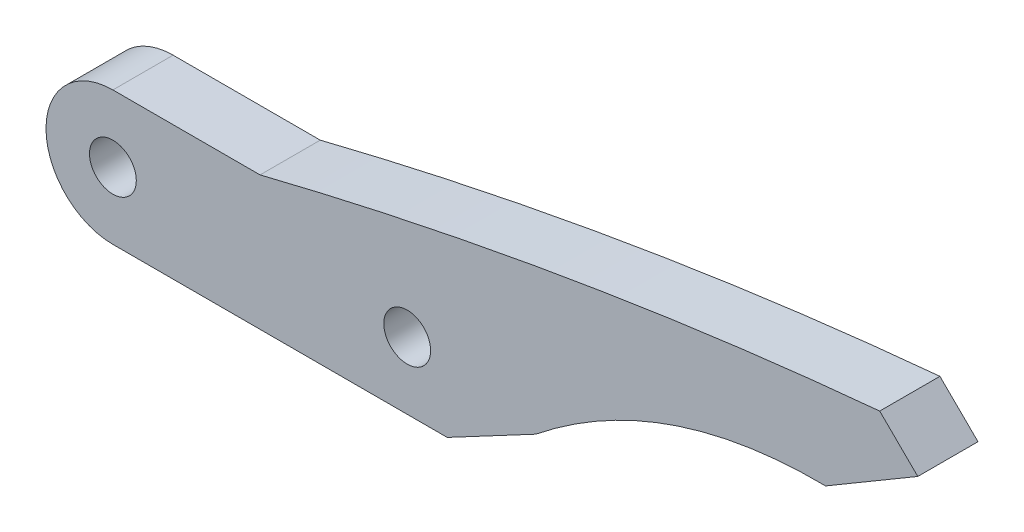
from build123d import *

# Parameters (mm, degrees)
SKETCH1_R           = 5
SKETCH1_R_2         = 1.75
BOSS_EXTRUDE1_DEPTH = 4.5
BOSS_EXTRUDE2_START = -4.5
BOSS_EXTRUDE2_DEPTH = 4.5


with BuildPart() as part:
    # Sketch1 → Boss-Extrude1 (new body)
    # profile 1 of 3: a face of its own
    with BuildSketch(Plane.XY):
        with BuildLine():
            Line((11.000000016, 5), (-11, 5))
            ThreePointArc((-11, 5), (-7.464466094, 3.535533906), (-6, 0))
            ThreePointArc((-6, 0), (-7.464466094, -3.535533906), (-11, -5))
            Line((-11, -5), (11, -5))
            ThreePointArc((11, -5), (6, 8e-09), (11.000000016, 5))
        make_face()
    # profile 2 of 3: a face of its own
    with BuildSketch(Plane.XY):
        with Locations((-11, 0)):
            Circle(SKETCH1_R)
        with Locations((-11, 0)):
            Circle(SKETCH1_R_2, mode=Mode.SUBTRACT)
    # profile 3 of 3: a face of its own
    with BuildSketch(Plane.XY):
        with Locations((11, 0)):
            Circle(SKETCH1_R)
        with Locations((11, 0)):
            Circle(SKETCH1_R_2, mode=Mode.SUBTRACT)
    extrude(amount=BOSS_EXTRUDE1_DEPTH)

    # Sketch2 → Boss-Extrude2 (add)
    with BuildSketch(Plane.XY.offset(4.5).offset(BOSS_EXTRUDE2_START)):
        with BuildLine():
            Line((46.316479083, 12.87), (49.163214054, 10.06))
            Line((49.163214054, 10.06), (42.27, 6))
            add(Edge.make_bspline(
                [(42.27, 6), (30.146150748, 6.157348305), (20.61, -1.48)],
                knots=[0, 0, 0, 1, 1, 1], degree=2))
            Line((20.61, -1.48), (13.99, -5))
            Line((13.99, -5), (11, -5))
            ThreePointArc((11, -5), (16, 0), (11, 5))
            Line((11, 5), (0, 5))
            add(Edge.make_bspline(
                [(0, 5), (22.862881716, 10.69974244), (46.316479083, 12.87)],
                knots=[0, 0, 0, 1, 1, 1], degree=2))
        make_face()
    extrude(amount=BOSS_EXTRUDE2_DEPTH)


solid = part.part
